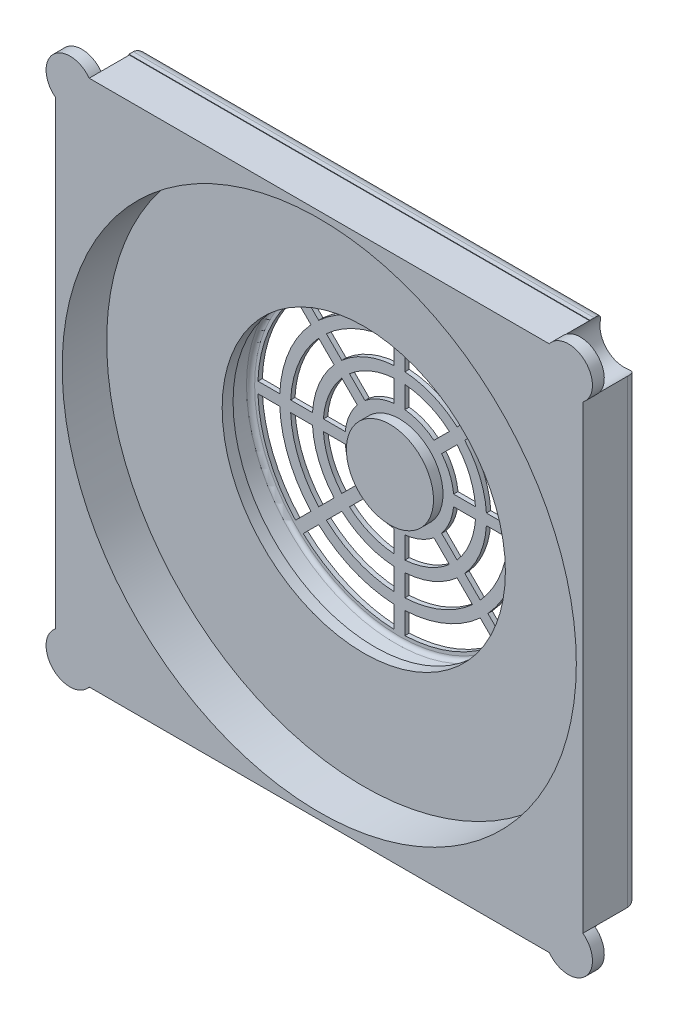
from build123d import *

# Parameters (mm, degrees)
SKETCH2_R            = 118
BOSS_EXTRUDE8_DEPTH  = 20
SKETCH7_W            = 242
SKETCH7_H            = 242.45858824
BOSS_EXTRUDE9_DEPTH  = 2
SKETCH8_R            = 67.5
CUT_EXTRUDE7_DEPTH   = 2
SKETCH9_W            = 242
SKETCH9_H            = 242.45858824
BOSS_EXTRUDE10_DEPTH = 7
SKETCH10_R           = 11
CUT_EXTRUDE8_DEPTH   = 20
CUT_EXTRUDE10_DEPTH  = 69
BOSS_EXTRUDE12_START = -21
SKETCH13_R           = 20
BOSS_EXTRUDE12_DEPTH = 21
CUT_EXTRUDE11_START  = -2
SKETCH14_R           = 118
CUT_EXTRUDE11_DEPTH  = 2
CUT_EXTRUDE12_START  = -12
SKETCH15_R           = 65
CUT_EXTRUDE12_DEPTH  = 12
FILLET1_R            = 5


with BuildPart() as part:
    # Sketch1 → Revolve9 (revolve)
    with BuildSketch(Plane(origin=(0, 0, 0), x_dir=(1, 0, 0), z_dir=(0, 1, 0)), mode=Mode.PRIVATE) as revolve9_sk:
        with BuildLine():
            Line((0, 21.542790465), (68.233380787, 21.542790465))
            ThreePointArc((68.233380787, 21.542790465), (69.55743015, 21.041754536), (70.21808321, 19.78968375))
            Line((70.21808321, 19.78968375), (71.662772412, 8.176252615))
            Line((71.662772412, 8.176252615), (118, 8.176252615))
            ThreePointArc((118, 8.176252615), (119.414213562, 7.590466178), (120, 6.176252615))
            Line((120, 6.176252615), (120, 2.737923598))
            Line((120, 2.737923598), (118, 2.737923598))
            Line((118, 2.737923598), (118, 6.176252615))
            Line((118, 6.176252615), (69.896153199, 6.176252615))
            Line((69.896153199, 6.176252615), (68.451463998, 17.78968375))
            ThreePointArc((68.451463998, 17.78968375), (67.790810938, 19.041754536), (66.466761575, 19.542790465))
            Line((66.466761575, 19.542790465), (0, 19.542790465))
            Line((0, 19.542790465), (0, 21.542790465))
        make_face()
    revolve(revolve9_sk.sketch.rotate(Axis((0, 0, -66.796199367), (0, 0, 1)), 180), axis=Axis((0, 0, -66.796199367), (0, 0, 1)))

    # Sketch2 → Boss-Extrude8 (add)
    with BuildSketch(Plane.XY.offset(-2.737923598)):
        with BuildLine():
            Line((-121, -105.598353442), (-121, 105.598353442))
            ThreePointArc((-121, 105.598353442), (-122.171572875, 122.171572875), (-105.598353442, 121))
            Line((-105.598353442, 121), (105.598353442, 121))
            ThreePointArc((105.598353442, 121), (122.171572875, 122.171572875), (121, 105.598353442))
            Line((121, 105.598353442), (121, -105.598353442))
            ThreePointArc((121, -105.598353442), (122.171572875, -122.171572875), (105.598353442, -121))
            Line((105.598353442, -121), (-105.598353442, -121))
            ThreePointArc((-105.598353442, -121), (-122.171572875, -122.171572875), (-121, -105.598353442))
        make_face()
        with Locations(Location((0, 0, 0), (0, 0, 180))):
            Circle(SKETCH2_R, mode=Mode.SUBTRACT)
    extrude(amount=BOSS_EXTRUDE8_DEPTH)

    # Sketch7 → Boss-Extrude9 (add)
    with BuildSketch(Plane.XY.offset(-6.176252615)):
        Rectangle(SKETCH7_W, SKETCH7_H)
    extrude(amount=-BOSS_EXTRUDE9_DEPTH)

    # Sketch8 → Cut-Extrude7 (cut)
    with BuildSketch(Plane.XY.offset(-6.176252615)):
        Circle(SKETCH8_R)
    extrude(amount=-CUT_EXTRUDE7_DEPTH, mode=Mode.SUBTRACT)

    # Sketch9 → Boss-Extrude10 (add)
    with BuildSketch(Plane(origin=(0, 0, -8.176252615), x_dir=(-1, 0, 0), z_dir=(0, 0, -1))):
        Rectangle(SKETCH9_W, SKETCH9_H)
    extrude(amount=-BOSS_EXTRUDE10_DEPTH)

    # Sketch10 → Cut-Extrude8 (cut)
    with BuildSketch(Plane(origin=(0, 0, -8.176252615), x_dir=(-1, 0, 0), z_dir=(0, 0, -1))):
        with Locations((-114.393398282, 114.393398282)):
            Circle(SKETCH10_R)
        with Locations((114.393398282, 114.393398282)):
            Circle(SKETCH10_R)
        with Locations((-114.393398282, -114.393398282)):
            Circle(SKETCH10_R)
        with Locations((114.393398282, -114.393398282)):
            Circle(SKETCH10_R)
    extrude(amount=-CUT_EXTRUDE8_DEPTH, mode=Mode.SUBTRACT)

    # Sketch11 → Cut-Extrude10 (cut)
    with BuildSketch(Plane(origin=(0, 0, -21.542790465), x_dir=(-1, 0, 0), z_dir=(0, 0, -1))):
        with BuildLine():
            ThreePointArc((-40.618442623, 37.082908717), (-50.813374288, 21.04758878), (-54.94315244, 2.5))
            Line((-54.94315244, 2.5), (-64.951905284, 2.5))
            ThreePointArc((-64.951905284, 2.5), (-60.052169613, 24.874423104), (-47.69569963, 44.160165724))
            Line((-47.69569963, 44.160165724), (-40.618442623, 37.082908717))
        make_face()
        with BuildLine():
            ThreePointArc((-29.99674143, 26.461207524), (-36.9551813, 15.307337295), (-39.921798557, 2.5))
            Line((-39.921798557, 2.5), (-49.937460889, 2.5))
            ThreePointArc((-49.937460889, 2.5), (-46.193976626, 19.134171618), (-37.078884183, 33.543350277))
            Line((-37.078884183, 33.543350277), (-29.99674143, 26.461207524))
        make_face()
        with BuildLine():
            ThreePointArc((-2.5, 54.94315244), (-21.04758878, 50.813374288), (-37.082908717, 40.618442623))
            Line((-37.082908717, 40.618442623), (-44.160165724, 47.69569963))
            ThreePointArc((-44.160165724, 47.69569963), (-24.874423104, 60.052169613), (-2.5, 64.951905284))
            Line((-2.5, 64.951905284), (-2.5, 54.94315244))
        make_face()
        with BuildLine():
            ThreePointArc((-2.5, 39.921798557), (-15.307337295, 36.9551813), (-26.461207524, 29.99674143))
            Line((-26.461207524, 29.99674143), (-33.543350277, 37.078884183))
            ThreePointArc((-33.543350277, 37.078884183), (-19.134171618, 46.193976626), (-2.5, 49.937460889))
            Line((-2.5, 49.937460889), (-2.5, 39.921798557))
        make_face()
        with BuildLine():
            ThreePointArc((-2.5, 24.874685928), (-9.567085809, 23.096988313), (-15.821292146, 19.356826052))
            Line((-15.821292146, 19.356826052), (-22.91775512, 26.453289026))
            ThreePointArc((-22.91775512, 26.453289026), (-13.393920133, 32.335783638), (-2.5, 34.910600109))
            Line((-2.5, 34.910600109), (-2.5, 24.874685928))
        make_face()
        with BuildLine():
            ThreePointArc((-19.356826052, 15.821292146), (-23.096988313, 9.567085809), (-24.874685928, 2.5))
            Line((-24.874685928, 2.5), (-34.910600109, 2.5))
            ThreePointArc((-34.910600109, 2.5), (-32.335783638, 13.393920133), (-26.453289026, 22.91775512))
            Line((-26.453289026, 22.91775512), (-19.356826052, 15.821292146))
        make_face()
        with BuildLine():
            ThreePointArc((-24.874685928, -2.5), (-23.096988313, -9.567085809), (-19.356826052, -15.821292146))
            Line((-19.356826052, -15.821292146), (-26.453289026, -22.91775512))
            ThreePointArc((-26.453289026, -22.91775512), (-32.335783638, -13.393920133), (-34.910600109, -2.5))
            Line((-34.910600109, -2.5), (-24.874685928, -2.5))
        make_face()
        with BuildLine():
            ThreePointArc((-54.94315244, -2.5), (-50.813374288, -21.04758878), (-40.618442623, -37.082908717))
            Line((-40.618442623, -37.082908717), (-47.69569963, -44.160165724))
            ThreePointArc((-47.69569963, -44.160165724), (-60.052169613, -24.874423104), (-64.951905284, -2.5))
            Line((-64.951905284, -2.5), (-54.94315244, -2.5))
        make_face()
        with BuildLine():
            ThreePointArc((-37.082908717, -40.618442623), (-21.04758878, -50.813374288), (-2.5, -54.94315244))
            Line((-2.5, -54.94315244), (-2.5, -64.951905284))
            ThreePointArc((-2.5, -64.951905284), (-24.874423104, -60.052169613), (-44.160165724, -47.69569963))
            Line((-44.160165724, -47.69569963), (-37.082908717, -40.618442623))
        make_face()
        with BuildLine():
            ThreePointArc((-15.821292146, -19.356826052), (-9.567085809, -23.096988313), (-2.5, -24.874685928))
            Line((-2.5, -24.874685928), (-2.5, -34.910600109))
            ThreePointArc((-2.5, -34.910600109), (-13.393920133, -32.335783638), (-22.91775512, -26.453289026))
            Line((-22.91775512, -26.453289026), (-15.821292146, -19.356826052))
        make_face()
        with BuildLine():
            Line((-2.5, -6.035533906), (-12.263448247, -15.798982153))
            ThreePointArc((-12.263448247, -15.798982153), (-7.653668647, -18.47759065), (-2.5, -19.843134833))
            Line((-2.5, -19.843134833), (-2.5, -6.035533906))
        make_face()
        with BuildLine():
            ThreePointArc((2.5, -54.94315244), (21.04758878, -50.813374288), (37.082908717, -40.618442623))
            Line((37.082908717, -40.618442623), (44.160165724, -47.69569963))
            ThreePointArc((44.160165724, -47.69569963), (24.874423104, -60.052169613), (2.5, -64.951905284))
            Line((2.5, -64.951905284), (2.5, -54.94315244))
        make_face()
        with BuildLine():
            ThreePointArc((2.5, -39.921798557), (15.307337295, -36.9551813), (26.461207524, -29.99674143))
            Line((26.461207524, -29.99674143), (33.543350277, -37.078884183))
            ThreePointArc((33.543350277, -37.078884183), (19.134171618, -46.193976626), (2.5, -49.937460889))
            Line((2.5, -49.937460889), (2.5, -39.921798557))
        make_face()
        with BuildLine():
            ThreePointArc((2.5, -24.874685928), (9.567085809, -23.096988313), (15.821292146, -19.356826052))
            Line((15.821292146, -19.356826052), (22.91775512, -26.453289026))
            ThreePointArc((22.91775512, -26.453289026), (13.393920133, -32.335783638), (2.5, -34.910600109))
            Line((2.5, -34.910600109), (2.5, -24.874685928))
        make_face()
        with BuildLine():
            Line((2.5, -6.035533906), (2.5, -19.843134833))
            ThreePointArc((2.5, -19.843134833), (7.653668647, -18.47759065), (12.263448247, -15.798982153))
            Line((12.263448247, -15.798982153), (2.5, -6.035533906))
        make_face()
        with BuildLine():
            ThreePointArc((19.356826052, -15.821292146), (23.096988313, -9.567085809), (24.874685928, -2.5))
            Line((24.874685928, -2.5), (34.910600109, -2.5))
            ThreePointArc((34.910600109, -2.5), (32.335783638, -13.393920133), (26.453289026, -22.91775512))
            Line((26.453289026, -22.91775512), (19.356826052, -15.821292146))
        make_face()
        with BuildLine():
            ThreePointArc((29.99674143, -26.461207524), (36.9551813, -15.307337295), (39.921798557, -2.5))
            Line((39.921798557, -2.5), (49.937460889, -2.5))
            ThreePointArc((49.937460889, -2.5), (46.193976626, -19.134171618), (37.078884183, -33.543350277))
            Line((37.078884183, -33.543350277), (29.99674143, -26.461207524))
        make_face()
        with BuildLine():
            ThreePointArc((40.618442623, -37.082908717), (50.813374288, -21.04758878), (54.94315244, -2.5))
            Line((54.94315244, -2.5), (64.951905284, -2.5))
            ThreePointArc((64.951905284, -2.5), (60.052169613, -24.874423104), (47.69569963, -44.160165724))
            Line((47.69569963, -44.160165724), (40.618442623, -37.082908717))
        make_face()
        with BuildLine():
            Line((15.798982153, 12.263448247), (6.035533906, 2.5))
            Line((6.035533906, 2.5), (19.843134833, 2.5))
            ThreePointArc((19.843134833, 2.5), (18.47759065, 7.653668647), (15.798982153, 12.263448247))
        make_face()
        with BuildLine():
            ThreePointArc((19.356826052, 15.821292146), (23.096988313, 9.567085809), (24.874685928, 2.5))
            Line((24.874685928, 2.5), (34.910600109, 2.5))
            ThreePointArc((34.910600109, 2.5), (32.335783638, 13.393920133), (26.453289026, 22.91775512))
            Line((26.453289026, 22.91775512), (19.356826052, 15.821292146))
        make_face()
        with BuildLine():
            ThreePointArc((29.99674143, 26.461207524), (36.9551813, 15.307337295), (39.921798557, 2.5))
            Line((39.921798557, 2.5), (49.937460889, 2.5))
            ThreePointArc((49.937460889, 2.5), (46.193976626, 19.134171618), (37.078884183, 33.543350277))
            Line((37.078884183, 33.543350277), (29.99674143, 26.461207524))
        make_face()
        with BuildLine():
            Line((2.5, 6.035533906), (12.263448247, 15.798982153))
            ThreePointArc((12.263448247, 15.798982153), (7.653668647, 18.47759065), (2.5, 19.843134833))
            Line((2.5, 19.843134833), (2.5, 6.035533906))
        make_face()
        with BuildLine():
            ThreePointArc((15.821292146, 19.356826052), (9.567085809, 23.096988313), (2.5, 24.874685928))
            Line((2.5, 24.874685928), (2.5, 34.910600109))
            ThreePointArc((2.5, 34.910600109), (13.393920133, 32.335783638), (22.91775512, 26.453289026))
            Line((22.91775512, 26.453289026), (15.821292146, 19.356826052))
        make_face()
        with BuildLine():
            ThreePointArc((26.461207524, 29.99674143), (15.307337295, 36.9551813), (2.5, 39.921798557))
            Line((2.5, 39.921798557), (2.5, 49.937460889))
            ThreePointArc((2.5, 49.937460889), (19.134171618, 46.193976626), (33.543350277, 37.078884183))
            Line((33.543350277, 37.078884183), (26.461207524, 29.99674143))
        make_face()
        with BuildLine():
            ThreePointArc((37.082908717, 40.618442623), (21.04758878, 50.813374288), (2.5, 54.94315244))
            Line((2.5, 54.94315244), (2.5, 64.951905284))
            ThreePointArc((2.5, 64.951905284), (24.874423104, 60.052169613), (44.160165724, 47.69569963))
            Line((44.160165724, 47.69569963), (37.082908717, 40.618442623))
        make_face()
        with BuildLine():
            ThreePointArc((40.618442623, 37.082908717), (50.813374288, 21.04758878), (54.94315244, 2.5))
            Line((54.94315244, 2.5), (64.951905284, 2.5))
            ThreePointArc((64.951905284, 2.5), (60.052169613, 24.874423104), (47.69569963, 44.160165724))
            Line((47.69569963, 44.160165724), (40.618442623, 37.082908717))
        make_face()
        with BuildLine():
            ThreePointArc((-49.937460889, -2.5), (-46.193976626, -19.134171618), (-37.078884183, -33.543350277))
            Line((-37.078884183, -33.543350277), (-29.99674143, -26.461207524))
            ThreePointArc((-29.99674143, -26.461207524), (-36.9551813, -15.307337295), (-39.921798557, -2.5))
            Line((-39.921798557, -2.5), (-49.937460889, -2.5))
        make_face()
        with BuildLine():
            ThreePointArc((-26.461207524, -29.99674143), (-15.307337295, -36.9551813), (-2.5, -39.921798557))
            Line((-2.5, -39.921798557), (-2.5, -49.937460889))
            ThreePointArc((-2.5, -49.937460889), (-19.134171618, -46.193976626), (-33.543350277, -37.078884183))
            Line((-33.543350277, -37.078884183), (-26.461207524, -29.99674143))
        make_face()
        with BuildLine():
            ThreePointArc((15.798982153, -12.263448247), (18.47759065, -7.653668647), (19.843134833, -2.5))
            Line((19.843134833, -2.5), (6.035533906, -2.5))
            Line((6.035533906, -2.5), (15.798982153, -12.263448247))
        make_face()
    extrude(amount=-CUT_EXTRUDE10_DEPTH, mode=Mode.SUBTRACT)

    # Sketch13 → Boss-Extrude12 (add)
    with BuildSketch(Plane.XY.offset(-1.176252615).offset(BOSS_EXTRUDE12_START)):
        Circle(SKETCH13_R)
    extrude(amount=BOSS_EXTRUDE12_DEPTH)

    # Sketch14 → Cut-Extrude11 (cut)
    with BuildSketch(Plane.XY.offset(-1.176252615).offset(CUT_EXTRUDE11_START)):
        Circle(SKETCH14_R)
    extrude(amount=CUT_EXTRUDE11_DEPTH, mode=Mode.SUBTRACT)

    # Sketch15 → Cut-Extrude12 (cut)
    with BuildSketch(Plane.XY.offset(-3.176252615).offset(CUT_EXTRUDE12_START)):
        Circle(SKETCH15_R)
    extrude(amount=CUT_EXTRUDE12_DEPTH, mode=Mode.SUBTRACT)

    # Fillet1
    fillet1_edges = [part.edges().sort_by_distance(p)[0] for p in [
        (121, 0, -8.176252615),
        (-121, 0, -8.176252615),
        (0, -121.22929412, -8.176252615),
        (0, 121.22929412, -8.176252615),
    ]]
    fillet(fillet1_edges, radius=FILLET1_R)


solid = part.part
